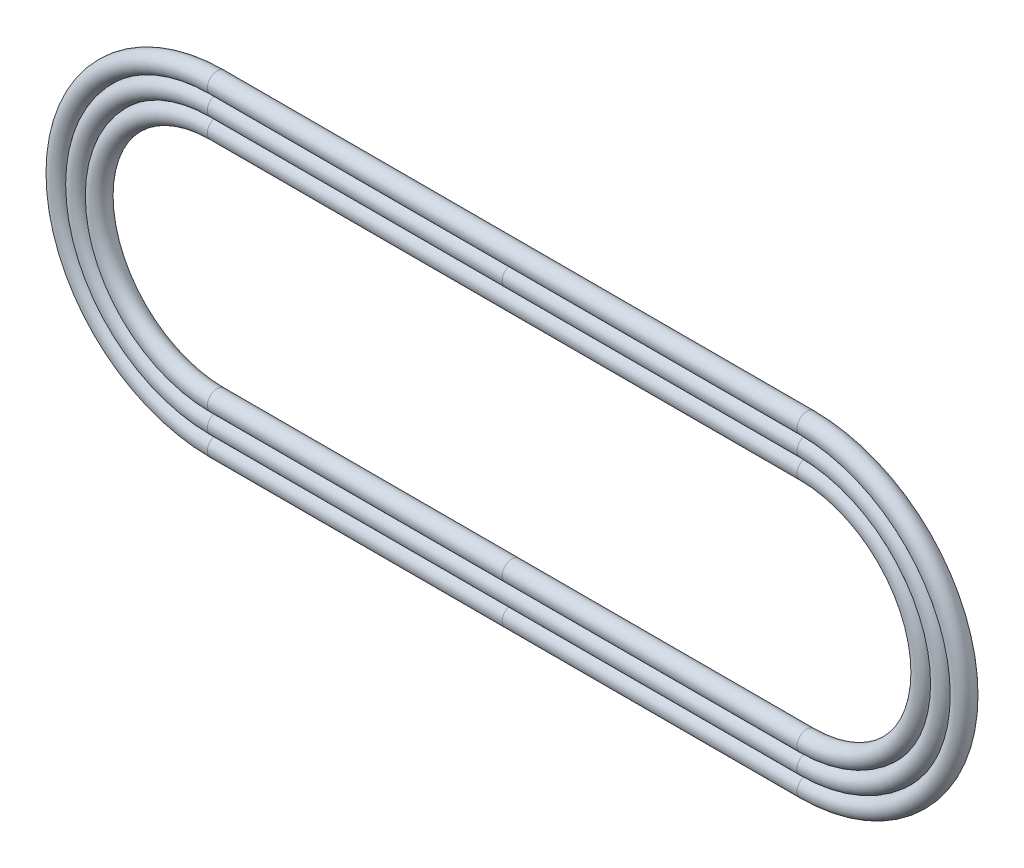
from build123d import *

# Parameters (mm, degrees)
SKETCH31_R = 50
SKETCH33_R = 50
SKETCH35_R = 50


with BuildPart() as part:
    # Sweep1: sweep along a path in Sketch30
    with BuildLine(Plane.XY) as sweep1_path:
        Line((-1500, 800), (1500, 800))
        ThreePointArc((1500, 800), (2300, 0), (1500, -800))
        Line((1500, -800), (-1500, -800))
        ThreePointArc((-1500, -800), (-2300, 0), (-1500, 800))
    # Sketch31 → Sweep1 (sweep)
    with BuildSketch(Plane(origin=(0, 0, 0), x_dir=(0, 0, -1), z_dir=(1, 0, 0))):
        with Locations((0, -800)):
            Circle(SKETCH31_R)
    sweep(path=sweep1_path.line)


with BuildPart() as body_2:
    # Sweep2: sweep along a path in Sketch32
    with BuildLine(Plane.XY) as sweep2_path:
        Line((-1500, 700), (1500, 700))
        ThreePointArc((1500, 700), (2200, 0), (1500, -700))
        Line((1500, -700), (-1500, -700))
        ThreePointArc((-1500, -700), (-2200, 0), (-1500, 700))
    # Sketch33 → Sweep2 (sweep)
    with BuildSketch(Plane(origin=(0, 0, 0), x_dir=(0, 0, -1), z_dir=(1, 0, 0))):
        with Locations((0, 700)):
            Circle(SKETCH33_R)
    sweep(path=sweep2_path.line)


with BuildPart() as body_3:
    # Sweep3: sweep along a path in Sketch34
    with BuildLine(Plane.XY) as sweep3_path:
        Line((-1500, 600), (1500, 600))
        ThreePointArc((1500, 600), (2100, 0), (1500, -600))
        Line((1500, -600), (-1500, -600))
        ThreePointArc((-1500, -600), (-2100, 0), (-1500, 600))
    # Sketch35 → Sweep3 (sweep)
    with BuildSketch(Plane(origin=(0, 0, 0), x_dir=(0, 0, -1), z_dir=(1, 0, 0))):
        with Locations((0, -600)):
            Circle(SKETCH35_R)
    sweep(path=sweep3_path.line)


solid = Compound([part.part, body_2.part, body_3.part])
